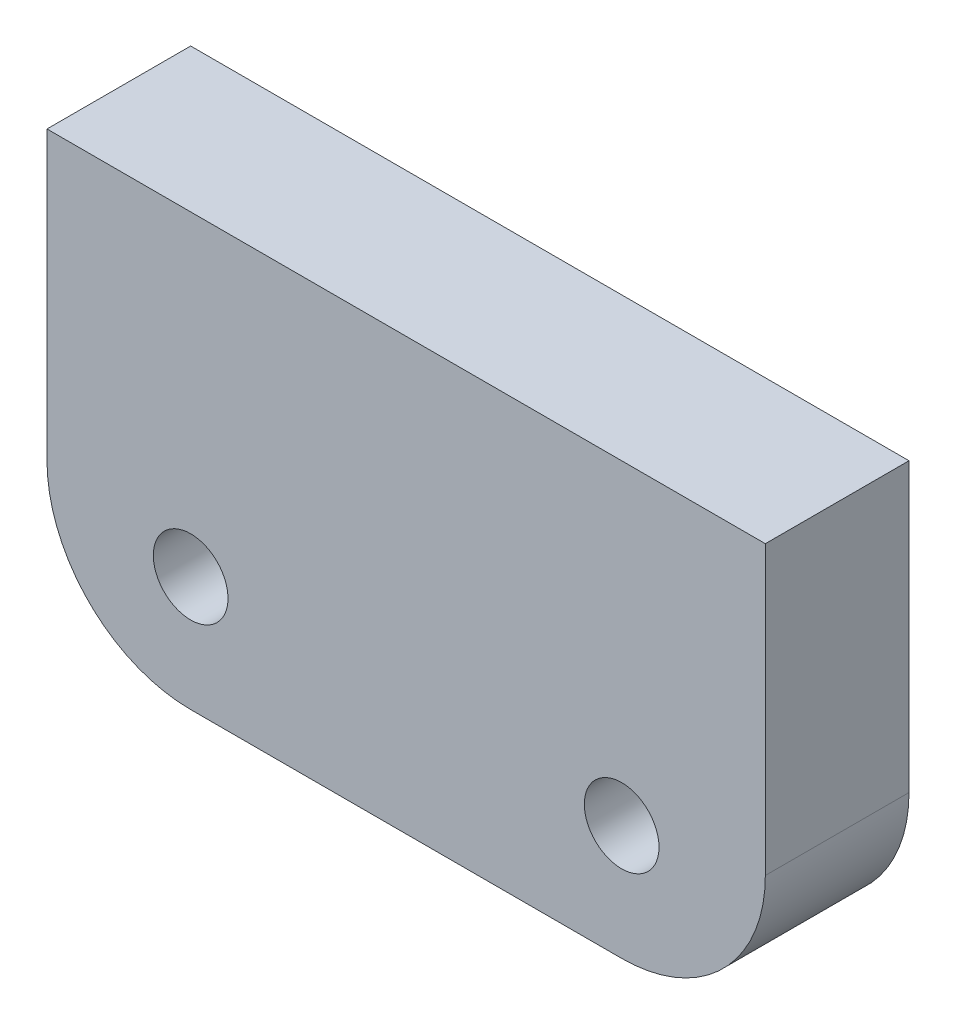
from build123d import *

# Parameters (mm, degrees)
SKETCH1_W           = 50
SKETCH1_H           = 30
BOSS_EXTRUDE1_DEPTH = 10
CUT_EXTRUDE1_DEPTH  = 5
SKETCH3_R           = 2.6
CUT_EXTRUDE2_DEPTH  = 451.671399096
FILLET1_R           = 10


with BuildPart() as part:
    # Sketch1 → Boss-Extrude1 (new body)
    with BuildSketch(Plane.XY):
        with Locations((0, 434.949674923)):
            Rectangle(SKETCH1_W, SKETCH1_H)
    extrude(amount=BOSS_EXTRUDE1_DEPTH)

    # Sketch2 → Cut-Extrude1 (cut)
    with BuildSketch(Plane(origin=(0, 0, 0), x_dir=(-1, 0, 0), z_dir=(0, 0, -1))):
        Polygon((11, 430.259075999), (15, 432.568477076), (19, 430.259075999), (19, 425.640273846), (15, 423.330872769), (11, 425.640273846), align=None)
        Polygon((-15, 432.568477076), (-19, 430.259075999), (-19, 425.640273846), (-15, 423.330872769), (-11, 425.640273846), (-11, 430.259075999), align=None)
    extrude(amount=-CUT_EXTRUDE1_DEPTH, mode=Mode.SUBTRACT)

    # Sketch3 → Cut-Extrude2 (cut, through all)
    with BuildSketch(Plane(origin=(0, 0, 5), x_dir=(-1, 0, 0), z_dir=(0, 0, -1))):
        with Locations((15, 427.949674923)):
            Circle(SKETCH3_R)
        with Locations(Location((-15, 427.949674923, 0), (0, 0, 180))):
            Circle(SKETCH3_R)
    extrude(amount=-CUT_EXTRUDE2_DEPTH, mode=Mode.SUBTRACT)

    # Fillet1
    fillet1_edges = [part.edges().sort_by_distance(p)[0] for p in [
        (25, 419.949674923, 5),
        (-25, 419.949674923, 5),
    ]]
    fillet(fillet1_edges, radius=FILLET1_R)


solid = part.part
